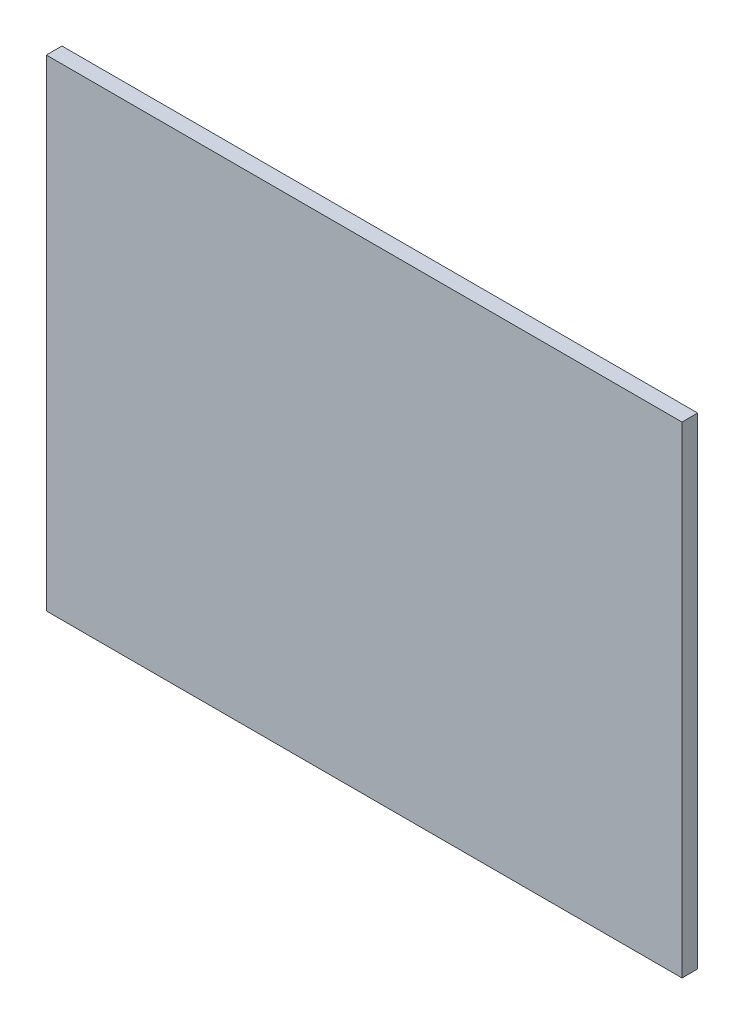
from build123d import *

# Parameters (mm, degrees)
SKETCH1_W           = 412.86877838
SKETCH1_H           = 312.7
BOSS_EXTRUDE1_DEPTH = 10.16


with BuildPart() as part:
    # Sketch1 → Boss-Extrude1 (new body)
    with BuildSketch(Plane.XY):
        with Locations((-0.06561081, -256.370125467)):
            Rectangle(SKETCH1_W, SKETCH1_H)
    extrude(amount=-BOSS_EXTRUDE1_DEPTH)


solid = part.part
